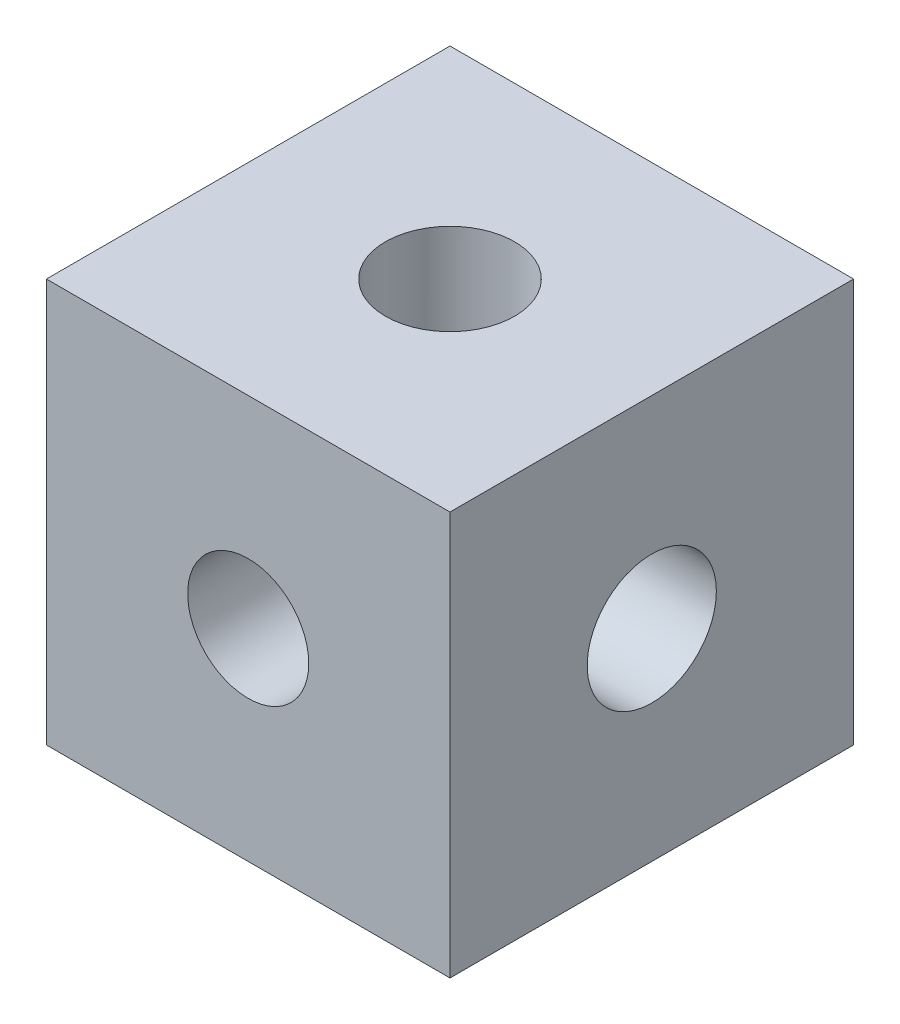
from build123d import *

# Parameters (mm, degrees)
SKETCH_1_W          = 10
SKETCH_1_H          = 10
EXTRUDE_1_DEPTH     = 10
SKETCH_2_R          = 1.5
CUT_EXTRUDE_1_DEPTH = 10
SKETCH_3_R          = 1.6
CUT_EXTRUDE_2_DEPTH = 10
SKETCH_4_R          = 1.6
CUT_EXTRUDE_3_DEPTH = 10


with BuildPart() as part:
    # 草图1 → 凸台-拉伸1 (new body)
    with BuildSketch(Plane(origin=(0, 0, 0), x_dir=(1, 0, 0), z_dir=(0, 1, 0))):
        with Locations((5, -5)):
            Rectangle(SKETCH_1_W, SKETCH_1_H)
    extrude(amount=EXTRUDE_1_DEPTH)

    # 草图2 → 切除-拉伸1 (cut)
    with BuildSketch(Plane.XY.offset(10)):
        with Locations((5, 5)):
            Circle(SKETCH_2_R)
    extrude(amount=-CUT_EXTRUDE_1_DEPTH, mode=Mode.SUBTRACT)

    # 草图3 → 切除-拉伸2 (cut)
    with BuildSketch(Plane(origin=(0, 10, 0), x_dir=(1, 0, 0), z_dir=(0, 1, 0))):
        with Locations(Location((5, -5, 0), (0, 0, 270))):
            Circle(SKETCH_3_R)
    extrude(amount=-CUT_EXTRUDE_2_DEPTH, mode=Mode.SUBTRACT)

    # 草图4 → 切除-拉伸3 (cut)
    with BuildSketch(Plane(origin=(10, 0, 0), x_dir=(0, 0, -1), z_dir=(1, 0, 0))):
        with Locations((-5, 5)):
            Circle(SKETCH_4_R)
    extrude(amount=-CUT_EXTRUDE_3_DEPTH, mode=Mode.SUBTRACT)


solid = part.part
